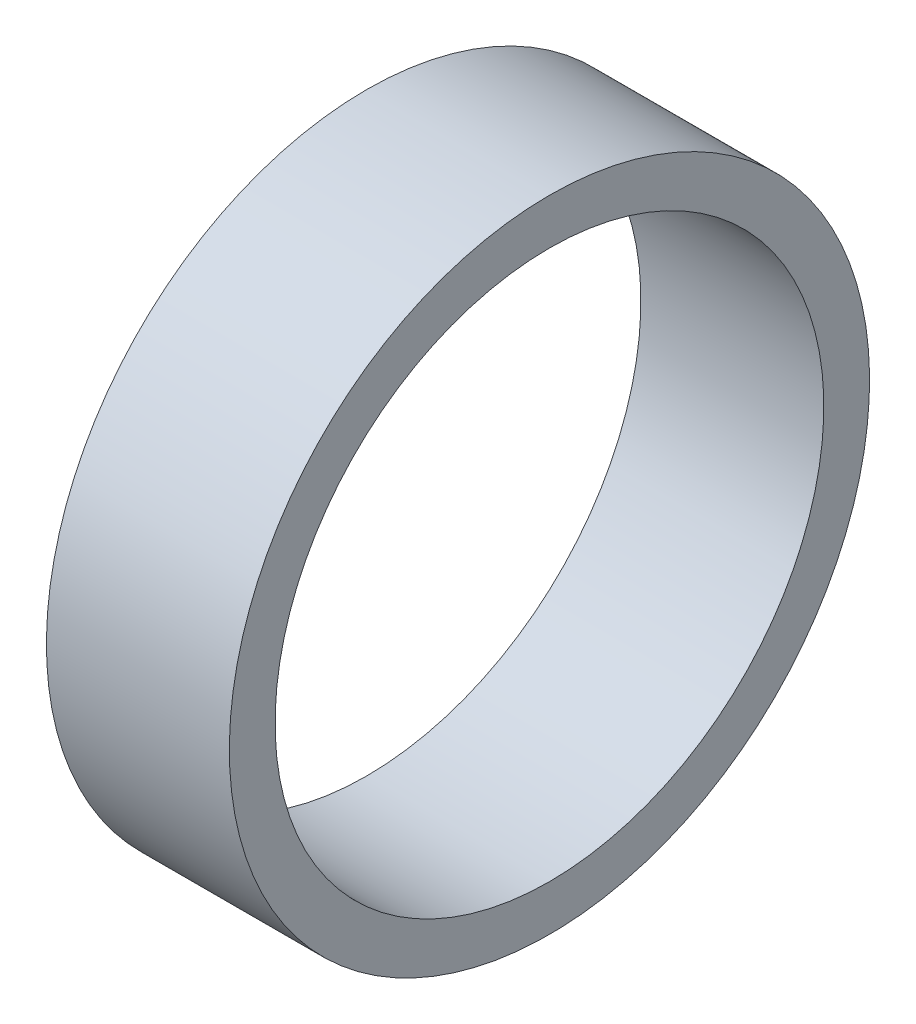
from build123d import *

# Parameters (mm, degrees)
SKETCH1_W      = 80
SKETCH1_H      = 20
REVOLVE1_ANGLE = 359.999999589


with BuildPart() as part:
    # Sketch1 → Revolve1 (revolve)
    with BuildSketch(Plane.XY):
        with Locations((1140, 130)):
            Rectangle(SKETCH1_W, SKETCH1_H)
    revolve(axis=Axis((0, 0, 0), (1, 0, 0)), revolution_arc=REVOLVE1_ANGLE)


solid = part.part
